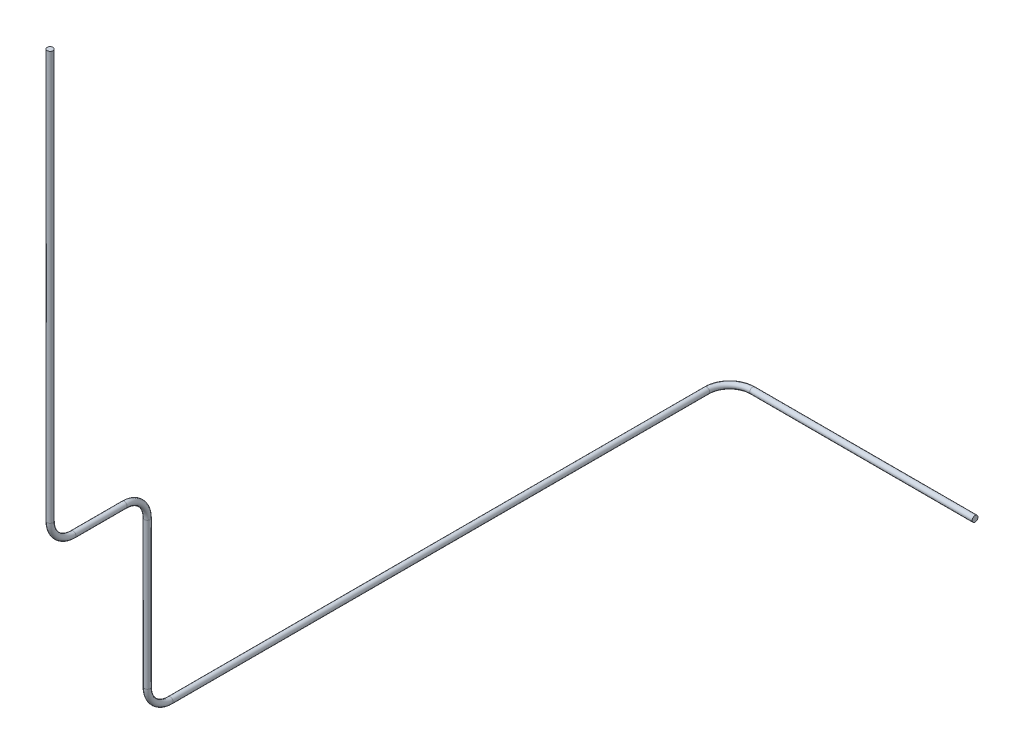
from build123d import *

# Parameters (mm, degrees)
BARRER1_PROFILE_R = 6.35


with BuildPart() as part:
    # Barrer1: sweep along a curve in space
    with BuildLine() as barrer1_path:
        Line((-937.241981619, -1278.810695772, 2027.32), (-1421.552983389, -1278.810695772, 2027.32))
        ThreePointArc((-1421.552983389, -1278.810695772, 2027.32), (-1456.908322449, -1278.810695772, 2041.964660941), (-1471.552983389, -1278.810695772, 2077.32))
        Line((-1471.552983389, -1278.810695772, 2077.32), (-1471.552983389, -1278.810695772, 3245.487357808))
        ThreePointArc((-1471.552983389, -1278.810695772, 3245.487357808), (-1471.552983389, -1264.166034831, 3280.842696867), (-1471.552983389, -1228.810695772, 3295.487357808))
        Line((-1471.552983389, -1228.810695772, 3295.487357808), (-1471.552983389, -910.190731412, 3295.487357808))
        ThreePointArc((-1471.552983389, -910.190731412, 3295.487357808), (-1471.552983389, -874.835392353, 3310.132018749), (-1471.552983389, -860.190731412, 3345.487357808))
        Line((-1471.552983389, -860.190731412, 3345.487357808), (-1471.552983389, -860.190731412, 3456.883033298))
        ThreePointArc((-1471.552983389, -860.190731412, 3456.883033298), (-1471.552983389, -845.546070472, 3492.238372357), (-1471.552983389, -810.190731412, 3506.883033298))
        Line((-1471.552983389, -810.190731412, 3506.883033298), (-1471.552983389, 79.733825002, 3506.883033298))
    # Barrer1 profile (on start of the path) → Barrer1 (sweep)
    with BuildSketch(Plane(origin=(-937.241981619, -1278.810695772, 2027.32), x_dir=(0, 0, -1), z_dir=(-1, 0, 0))):
        Circle(BARRER1_PROFILE_R)
    sweep(path=barrer1_path.line)


solid = part.part
